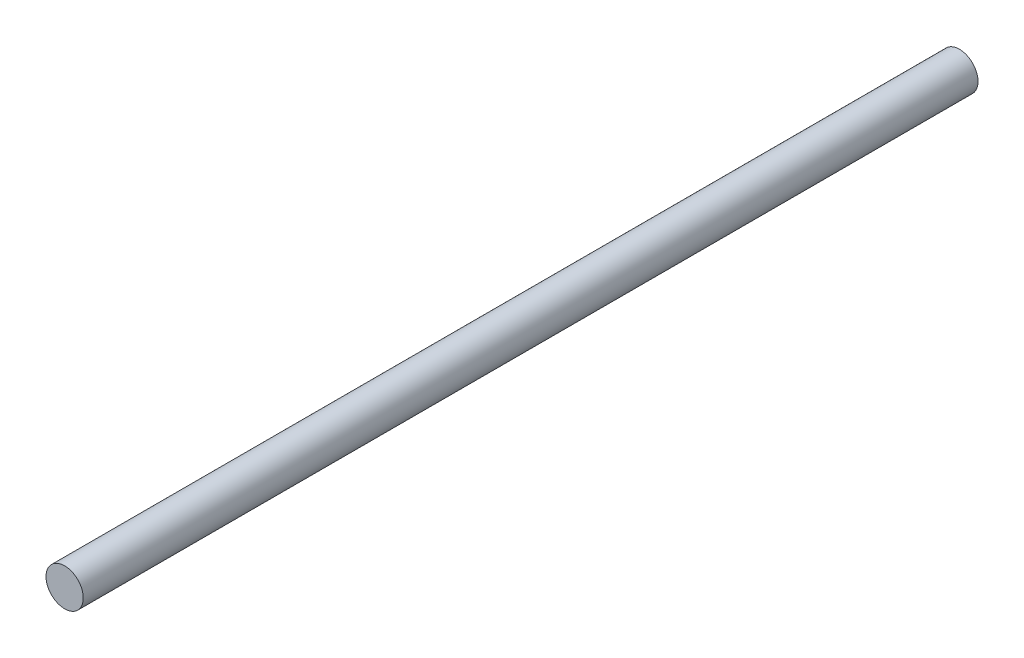
from build123d import *

# Parameters (mm, degrees)
SKETCH1_R           = 6.35
BOSS_EXTRUDE1_DEPTH = 304.8


with BuildPart() as part:
    # Sketch1 → Boss-Extrude1 (new body)
    with BuildSketch(Plane.XY):
        with Locations(Location((0, 0, 0), (0, 0, 180))):
            Circle(SKETCH1_R)
    extrude(amount=BOSS_EXTRUDE1_DEPTH)


solid = part.part
